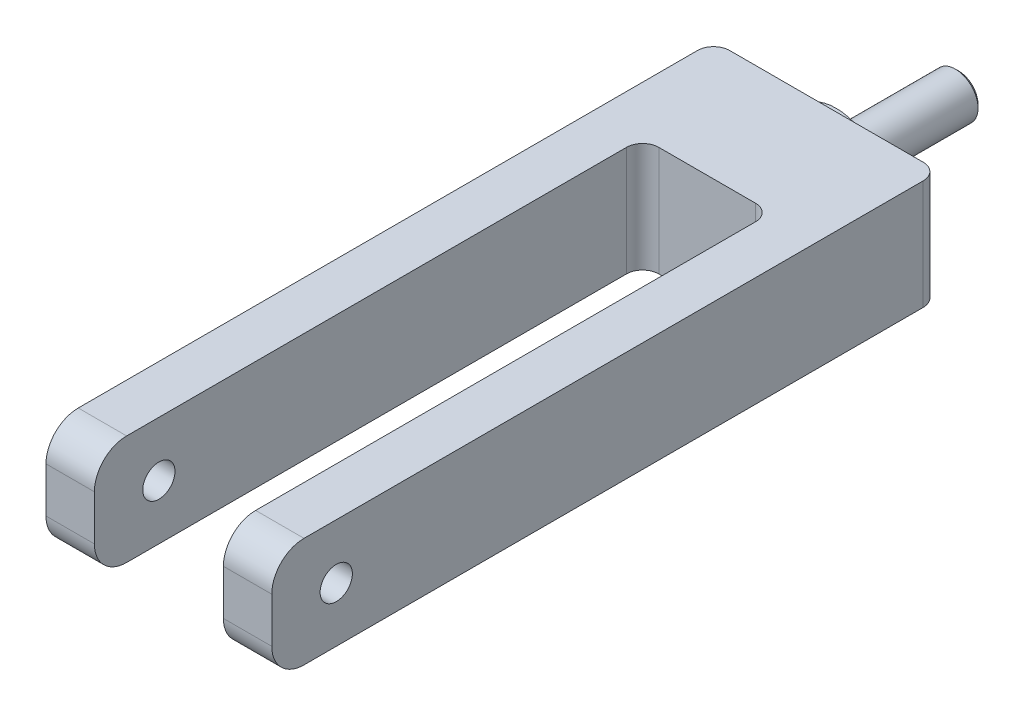
from build123d import *

# Parameters (mm, degrees)
EXTRUDE_1_DEPTH     = 17
FILLET_1_R          = 5
SKETCH_2_R          = 15
EXTRUDE_2_DEPTH     = 3
SKETCH_4_R          = 5
CUT_EXTRUDE_1_DEPTH = 56
SKETCH_3_R          = 7
EXTRUDE_3_DEPTH     = 38
FILLET_2_R          = 10
CHAMFER_1_SIZE      = 1


with BuildPart() as part:
    # 草图1 → 凸台-拉伸1 (new, symmetric)
    with BuildSketch(Plane(origin=(0, 0, 0), x_dir=(1, 0, 0), z_dir=(0, 1, 0))):
        Polygon((20, -87.093671679), (35, -87.093671679), (35, 119.906328321), (-35, 119.906328321), (-35, -87.093671679), (-20, -87.093671679), (-20, 82.906328321), (20, 82.906328321), align=None)
    extrude(amount=EXTRUDE_1_DEPTH, both=True)

    # 圆角1
    fillet_1_edges = [part.edges().sort_by_distance(p)[0] for p in [
        (-35, 0, -119.906328321),
        (35, 0, -119.906328321),
        (20, 0, -82.906328321),
        (-20, 0, -82.906328321),
    ]]
    fillet(fillet_1_edges, radius=FILLET_1_R)

    # 草图2 → 凸台-拉伸2 (add)
    with BuildSketch(Plane(origin=(0, 0, -119.906328321), x_dir=(-1, 0, 0), z_dir=(0, 0, -1))):
        with Locations(Location((0, 0, 0), (0, 0, 180))):
            Circle(SKETCH_2_R)
    extrude(amount=EXTRUDE_2_DEPTH)

    # 草图4 → 切除-拉伸1 (cut, symmetric)
    with BuildSketch(Plane(origin=(0, 0, 0), x_dir=(0, 0, -1), z_dir=(1, 0, 0))):
        with Locations((-67.093671679, 0)):
            Circle(SKETCH_4_R)
    extrude(amount=CUT_EXTRUDE_1_DEPTH, both=True, mode=Mode.SUBTRACT)

    # 草图3 → 凸台-拉伸3 (add)
    with BuildSketch(Plane(origin=(0, 0, -122.906328321), x_dir=(-1, 0, 0), z_dir=(0, 0, -1))):
        Circle(SKETCH_3_R)
    extrude(amount=EXTRUDE_3_DEPTH)

    # 圆角2
    fillet_2_edges = [part.edges().sort_by_distance(p)[0] for p in [
        (-27.5, -17, 87.093671679),
        (27.5, 17, 87.093671679),
        (-27.5, 17, 87.093671679),
        (27.5, -17, 87.093671679),
    ]]
    fillet(fillet_2_edges, radius=FILLET_2_R)

    # 倒角1
    chamfer_1_edges = [part.edges().sort_by_distance(p)[0] for p in [
        (7, 0, -160.906328321),
    ]]
    chamfer(chamfer_1_edges, length=CHAMFER_1_SIZE)


solid = part.part
